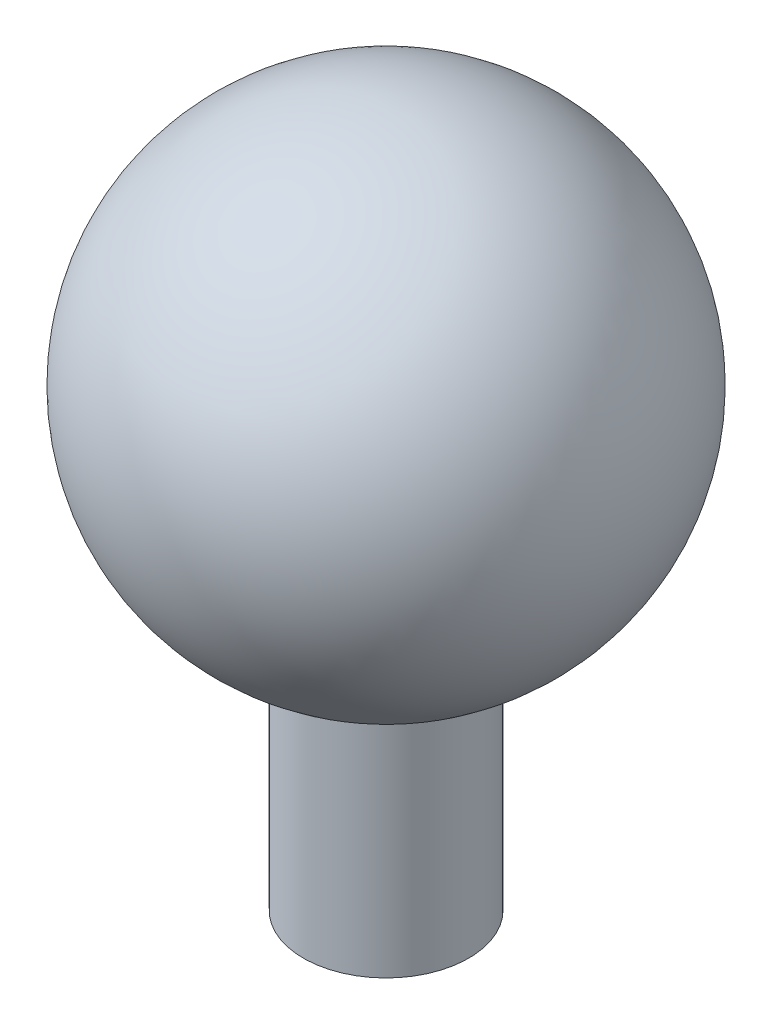
from build123d import *


with BuildPart() as part:
    # Sketch1 → Revolve1 (revolve)
    with BuildSketch(Plane.XY):
        with BuildLine():
            Line((0, 29), (0, -29))
            ThreePointArc((0, -29), (29, 0), (0, 29))
        make_face()
    revolve(axis=Axis((0, 29, 0), (0, -1, 0)))


with BuildPart() as body_2:
    # Sketch3 → Revolve2 (revolve)
    with BuildSketch(Plane.XY, mode=Mode.PRIVATE) as revolve2_sk:
        with BuildLine():
            Line((0, -30), (0, -55))
            Line((0, -55), (10, -55))
            Line((10, -55), (10, -27.221315178))
            ThreePointArc((10, -27.221315178), (5.121077734, -29.046395148), (0, -30))
        make_face()
    revolve(revolve2_sk.sketch.rotate(Axis((0, -30, 0), (0, -1, 0)), 180), axis=Axis((0, -30, 0), (0, -1, 0)))


solid = Compound([part.part, body_2.part])
